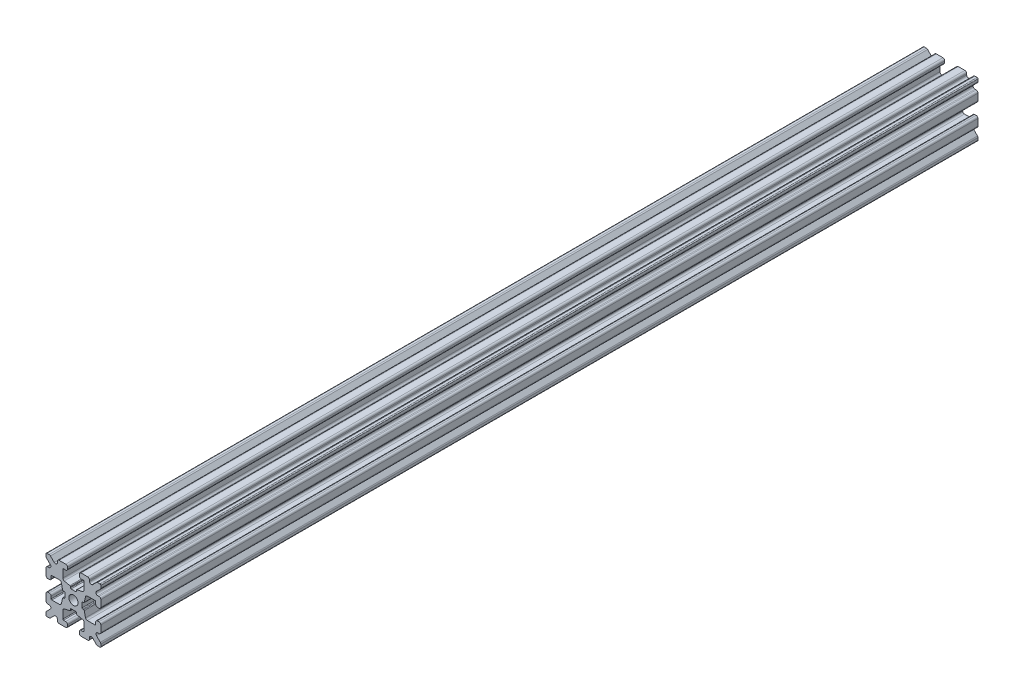
from build123d import *

# Parameters (mm, degrees)
SKETCH1_W           = 15
SKETCH1_H           = 15
SKETCH1_R           = 1.25
CHANGE_LENGTH_DEPTH = 120
FILLET1_R           = 0.25
CUT_EXTRUDE1_DEPTH  = 241.234260671
CUT_EXTRUDE3_DEPTH  = 241.234260671
FILLET3_R           = 0.5
FILLET4_R           = 0.5
FILLET5_R           = 3
FILLET6_R           = 0.2
CUT_EXTRUDE4_DEPTH  = 241.234260671
FILLET8_R           = 0.5
SKETCH6_W           = 5.1529354
SKETCH6_H           = 1.651
SKETCH6_W_2         = 1.651
SKETCH6_H_2         = 5.1529354
CUT_EXTRUDE5_DEPTH  = 241.234260671
FILLET10_R          = 0.2


with BuildPart() as part:
    # Sketch1 → Change length (new, symmetric)
    with BuildSketch(Plane.XY):
        Rectangle(SKETCH1_W, SKETCH1_H)
        Circle(SKETCH1_R, mode=Mode.SUBTRACT)
    extrude(amount=CHANGE_LENGTH_DEPTH, both=True)

    # Fillet1
    fillet1_edges = [part.edges().sort_by_distance(p)[0] for p in [
        (7.5, -7.5, 0),
        (-7.5, -7.5, 0),
        (-7.5, 7.5, 0),
        (7.5, 7.5, 0),
    ]]
    fillet(fillet1_edges, radius=FILLET1_R)

    # Sketch2 → Cut-Extrude1 (cut, through all)
    with BuildSketch(Plane.XY.offset(120)):
        Polygon((-7.5, 1.6), (-6.1, 1.6), (-6.1, 2.9), (-3.4, 2.9), (-3.4, -2.9), (-6.1, -2.9), (-6.1, -1.6), (-7.5, -1.6), align=None)
        Polygon((2.9, 6.1), (1.6, 6.1), (1.6, 7.5), (-1.6, 7.5), (-1.6, 6.1), (-2.9, 6.1), (-2.9, 3.4), (2.9, 3.4), align=None)
        Polygon((-1.6, -7.5), (-1.6, -6.1), (-2.9, -6.1), (-2.9, -3.4), (2.9, -3.4), (2.9, -6.1), (1.6, -6.1), (1.6, -7.5), align=None)
        Polygon((6.1, -2.9), (6.1, -1.6), (7.5, -1.6), (7.5, 1.6), (6.1, 1.6), (6.1, 2.9), (3.4, 2.9), (3.4, -2.9), align=None)
    extrude(amount=-CUT_EXTRUDE1_DEPTH, mode=Mode.SUBTRACT)

    # Sketch4 → Cut-Extrude3 (cut, through all)
    with BuildSketch(Plane.XY.offset(120)):
        Polygon((-3.4, 2.9), (-2.75, 0), (-3.4, -2.9), align=None)
        Polygon((-2.9, 3.4), (0, 2.75), (2.9, 3.4), align=None)
        Polygon((3.4, 2.9), (2.75, 0), (3.4, -2.9), align=None)
        Polygon((-2.9, -3.4), (0, -2.75), (2.9, -3.4), align=None)
    extrude(amount=-CUT_EXTRUDE3_DEPTH, mode=Mode.SUBTRACT)

    # Fillet3
    fillet3_edges = [part.edges().sort_by_distance(p)[0] for p in [
        (1.6, -7.5, 0),
        (-1.6, -7.5, 0),
        (-1.6, -6.1, 0),
        (1.6, -6.1, 0),
        (6.1, 1.6, 0),
        (7.5, 1.6, 0),
        (7.5, -1.6, 0),
        (6.1, -1.6, 0),
        (-7.5, -1.6, 0),
        (-7.5, 1.6, 0),
        (-6.1, 1.6, 0),
        (-6.1, -1.6, 0),
        (-1.6, 6.1, 0),
        (-1.6, 7.5, 0),
        (1.6, 7.5, 0),
        (1.6, 6.1, 0),
    ]]
    fillet(fillet3_edges, radius=FILLET3_R)

    # Fillet4
    fillet4_edges = [part.edges().sort_by_distance(p)[0] for p in [
        (-2.9, -3.4, 0),
        (2.9, -3.4, 0),
        (3.4, -2.9, 0),
        (3.4, 2.9, 0),
        (-3.4, 2.9, 0),
        (-3.4, -2.9, 0),
        (2.9, 3.4, 0),
        (-2.9, 3.4, 0),
    ]]
    fillet(fillet4_edges, radius=FILLET4_R)

    # Fillet5
    fillet5_edges = [part.edges().sort_by_distance(p)[0] for p in [
        (-2.75, 0, 0),
        (0, 2.75, 0),
        (2.75, 0, 0),
        (0, -2.75, 0),
    ]]
    fillet(fillet5_edges, radius=FILLET5_R)

    # Fillet6
    fillet6_edges = [part.edges().sort_by_distance(p)[0] for p in [
        (-2.9, -6.1, 0),
        (2.9, -6.1, 0),
        (6.1, -2.9, 0),
        (6.1, 2.9, 0),
        (-6.1, 2.9, 0),
        (-6.1, -2.9, 0),
        (2.9, 6.1, 0),
        (-2.9, 6.1, 0),
    ]]
    fillet(fillet6_edges, radius=FILLET6_R)

    # Sketch5 → Cut-Extrude4 (cut, through all)
    with BuildSketch(Plane.XY.offset(120)):
        Polygon((-7.5, 6.439339828), (-5.460660172, 4.4), (-7.5, 4.4), align=None)
        Polygon((-6.439339828, 7.5), (-4.4, 5.460660172), (-4.4, 7.5), align=None)
        Polygon((4.4, 7.5), (6.439339828, 7.5), (4.4, 5.460660172), align=None)
        Polygon((7.5, 6.439339828), (7.5, 4.4), (5.460660172, 4.4), align=None)
        Polygon((7.5, -6.439339828), (5.460660172, -4.4), (7.5, -4.4), align=None)
        Polygon((6.439339828, -7.5), (4.4, -5.460660172), (4.4, -7.5), align=None)
        Polygon((-4.4, -7.5), (-6.439339828, -7.5), (-4.4, -5.460660172), align=None)
        Polygon((-7.5, -6.439339828), (-7.5, -4.4), (-5.460660172, -4.4), align=None)
    extrude(amount=-CUT_EXTRUDE4_DEPTH, mode=Mode.SUBTRACT)

    # Fillet8
    fillet8_edges = [part.edges().sort_by_distance(p)[0] for p in [
        (-7.5, 4.4, 0),
        (-7.5, 6.439339828, 0),
        (-5.460660172, 4.4, 0),
        (7.5, -4.4, 0),
        (7.5, -6.439339828, 0),
        (5.460660172, -4.4, 0),
        (5.460660172, 4.4, 0),
        (7.5, 6.439339828, 0),
        (7.5, 4.4, 0),
        (-4.4, 7.5, 0),
        (-4.4, 5.460660172, 0),
        (-6.439339828, 7.5, 0),
        (-5.460660172, -4.4, 0),
        (-7.5, -6.439339828, 0),
        (-7.5, -4.4, 0),
        (4.4, 5.460660172, 0),
        (4.4, 7.5, 0),
        (6.439339828, 7.5, 0),
        (6.439339828, -7.5, 0),
        (4.4, -7.5, 0),
        (4.4, -5.460660172, 0),
        (-6.439339828, -7.5, 0),
        (-4.4, -5.460660172, 0),
        (-4.4, -7.5, 0),
    ]]
    fillet(fillet8_edges, radius=FILLET8_R)

    # Sketch6 → Cut-Extrude5 (cut, through all)
    with BuildSketch(Plane.XY.offset(120)):
        with Locations((4.9235323, 0)):
            Rectangle(SKETCH6_W, SKETCH6_H)
        with Locations((0, -4.9235323)):
            Rectangle(SKETCH6_W_2, SKETCH6_H_2)
        with Locations((-4.9235323, 0)):
            Rectangle(SKETCH6_W, SKETCH6_H)
        with Locations((0, 4.9235323)):
            Rectangle(SKETCH6_W_2, SKETCH6_H_2)
    extrude(amount=-CUT_EXTRUDE5_DEPTH, mode=Mode.SUBTRACT)

    # Fillet10
    fillet10_edges = [part.edges().sort_by_distance(p)[0] for p in [
        (0.8255, -2.935025862, 0),
        (-0.8255, -2.935025862, 0),
        (0.8255, -2.3470646, 0),
        (-0.8255, -2.3470646, 0),
        (2.935025862, 0.8255, 0),
        (2.935025862, -0.8255, 0),
        (2.3470646, 0.8255, 0),
        (2.3470646, -0.8255, 0),
        (-2.935025862, -0.8255, 0),
        (-2.935025862, 0.8255, 0),
        (-2.3470646, -0.8255, 0),
        (-2.3470646, 0.8255, 0),
        (-0.8255, 2.935025862, 0),
        (0.8255, 2.935025862, 0),
        (-0.8255, 2.3470646, 0),
        (0.8255, 2.3470646, 0),
    ]]
    fillet(fillet10_edges, radius=FILLET10_R)


solid = part.part
